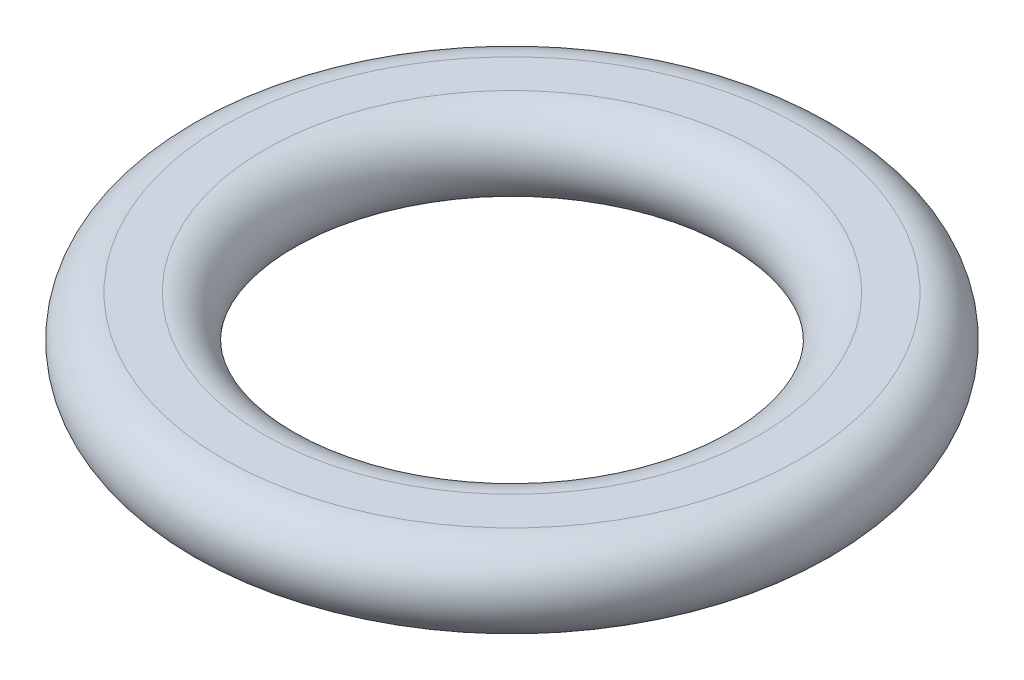
from build123d import *


with BuildPart() as part:
    # ProfileS → Profile (revolve)
    with BuildSketch(Plane.XY):
        with BuildLine():
            Line((3, 0.5), (3.5, 0.5))
            ThreePointArc((3.5, 0.5), (4, 0), (3.5, -0.5))
            Line((3.5, -0.5), (3, -0.5))
            ThreePointArc((3, -0.5), (2.5, 0), (3, 0.5))
        make_face()
    revolve(axis=Axis((0, 0.5, 0), (0, -1, 0)))


solid = part.part
